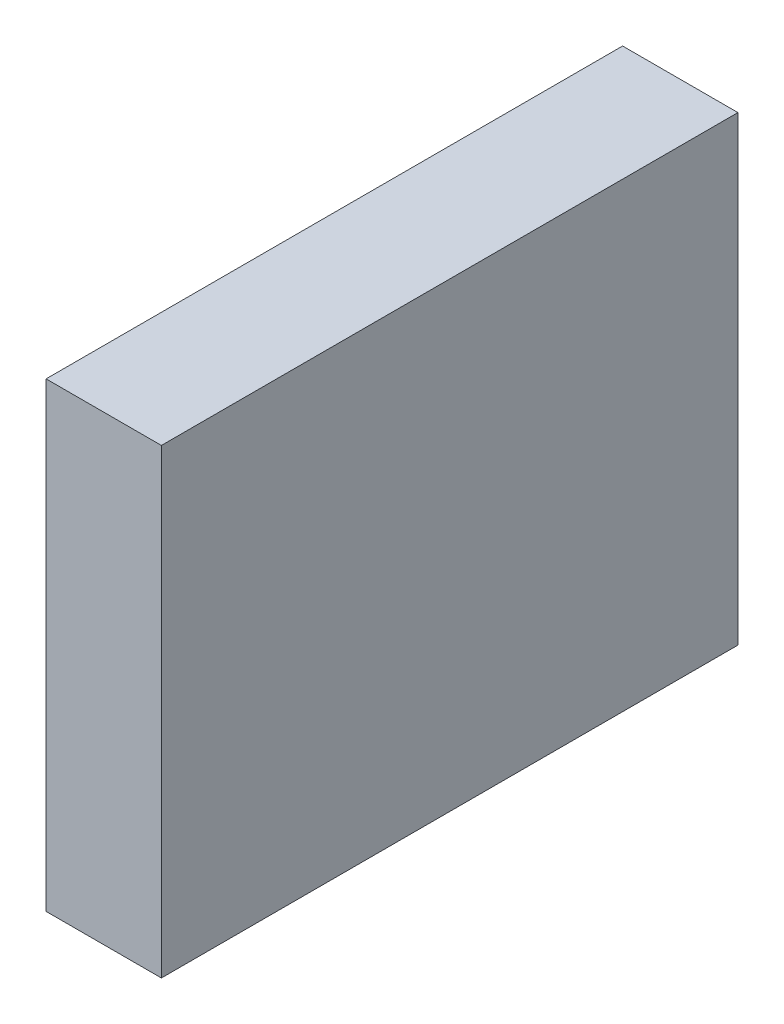
from build123d import *

# Parameters (mm, degrees)
SKETCH1_W           = 10
SKETCH1_H           = 50
BOSS_EXTRUDE1_DEPTH = 40


with BuildPart() as part:
    # Sketch1 → Boss-Extrude1 (new body)
    with BuildSketch(Plane(origin=(0, 0, 0), x_dir=(1, 0, 0), z_dir=(0, 1, 0))):
        Rectangle(SKETCH1_W, SKETCH1_H)
    extrude(amount=BOSS_EXTRUDE1_DEPTH)


solid = part.part
